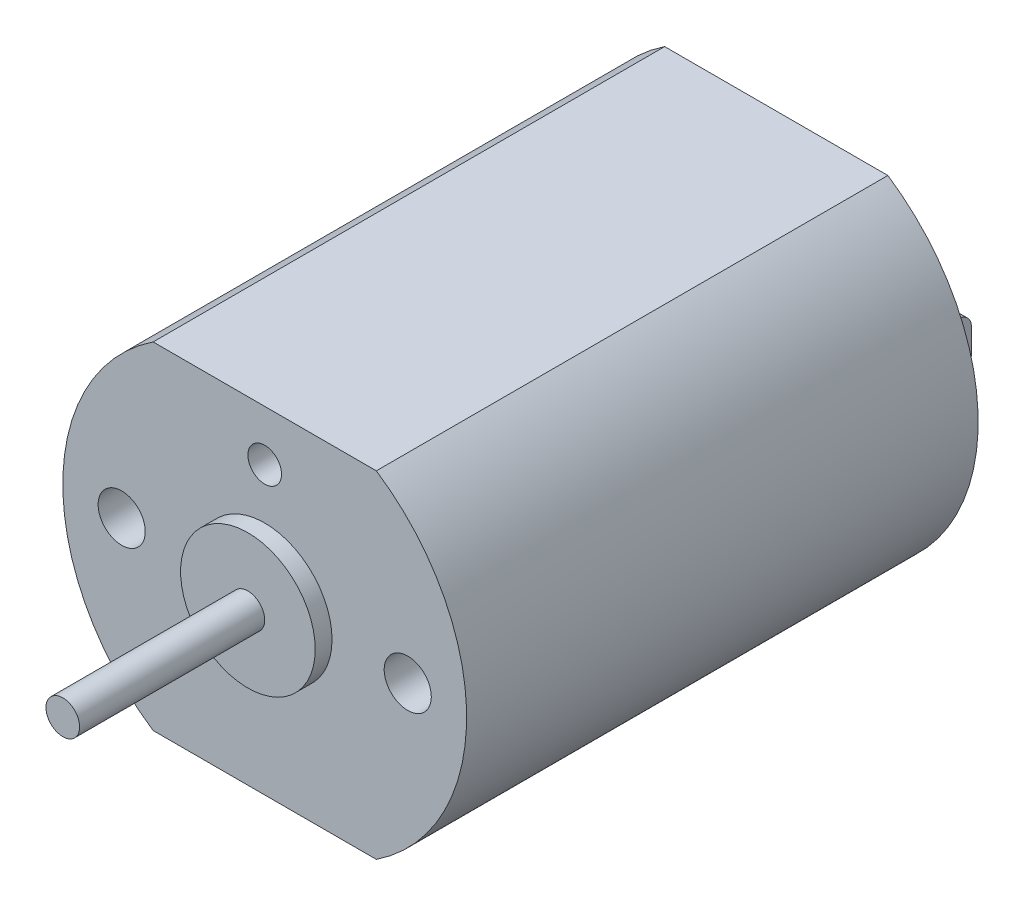
from build123d import *

# Parameters (mm, degrees)
SKETCH_1_W          = 0.3
SKETCH_1_H          = 1.5
SKETCH_1_R          = 2.5
SKETCH_1_R_2        = 1.5
EXTRUDE_1_DEPTH     = 15.2
SKETCH_1_4_W        = 0.3
SKETCH_1_4_H        = 1.5
EXTRUDE_2_DEPTH     = 2
CUT_EXTRUDE_2_DEPTH = 19.763794925
FILLET_1_R          = 0.4
SKETCH_1_5_R        = 2.5
SKETCH_1_5_R_2      = 1.5
EXTRUDE_3_DEPTH     = 1.2
CUT_EXTRUDE_START   = -1.2
SKETCH_1_7_R        = 1.5
CUT_EXTRUDE_1_DEPTH = 0.6
FILLET_2_R          = 0.4
SKETCH_3_R          = 2
EXTRUDE_4_DEPTH     = 0.5
SKETCH_3_3_R        = 0.5
EXTRUDE_5_DEPTH     = 6
SKETCH_4_R          = 0.7
SKETCH_4_R_2        = 0.5
CUT_EXTRUDE_3_DEPTH = 1


with BuildPart() as part:
    # 草图1 → 凸台-拉伸1 (new body)
    # profile 1 of 5: a face of its own
    with BuildSketch(Plane.XY):
        with BuildLine():
            ThreePointArc((-6, 0), (-5.286764074, -2.837274331), (-3.31662479, -5))
            Line((-3.31662479, -5), (3.31662479, -5))
            ThreePointArc((3.31662479, -5), (5.286764074, -2.837274331), (6, 0))
            ThreePointArc((6, 0), (5.286764074, 2.837274331), (3.31662479, 5))
            Line((3.31662479, 5), (-3.31662479, 5))
            ThreePointArc((-3.31662479, 5), (-5.286764074, 2.837274331), (-6, 0))
        make_face()
        with Locations((-3.65, 0)):
            Rectangle(SKETCH_1_W, SKETCH_1_H, mode=Mode.SUBTRACT)
        Circle(SKETCH_1_R, mode=Mode.SUBTRACT)
        with Locations((3.65, 0)):
            Rectangle(SKETCH_1_W, SKETCH_1_H, mode=Mode.SUBTRACT)
    # profile 2 of 5: a face of its own
    with BuildSketch(Plane.XY):
        Circle(SKETCH_1_R)
        Circle(SKETCH_1_R_2, mode=Mode.SUBTRACT)
    # profile 3 of 5: a face of its own
    with BuildSketch(Plane.XY):
        Circle(SKETCH_1_R_2)
    # profile 4 of 5: a face of its own
    with BuildSketch(Plane.XY):
        with Locations((3.65, 0)):
            Rectangle(SKETCH_1_W, SKETCH_1_H)
    # profile 5 of 5: a face of its own
    with BuildSketch(Plane.XY):
        with Locations((-3.65, 0)):
            Rectangle(SKETCH_1_W, SKETCH_1_H)
    extrude(amount=EXTRUDE_1_DEPTH)

    # 草图1<4> → 凸台-拉伸2 (add)
    with BuildSketch(Plane.XY):
        with Locations((3.65, 0)):
            Rectangle(SKETCH_1_4_W, SKETCH_1_4_H)
        with Locations((-3.65, 0)):
            Rectangle(SKETCH_1_4_W, SKETCH_1_4_H)
    extrude(amount=-EXTRUDE_2_DEPTH)

    # 草图2 → 切除-拉伸2 (cut, through all)
    with BuildSketch(Plane(origin=(3.8, 0, 0), x_dir=(0, 0, -1), z_dir=(1, 0, 0))):
        with BuildLine():
            Line((0.95, 0.45), (1.05, 0.45))
            ThreePointArc((1.05, 0.45), (1.5, 0), (1.05, -0.45))
            Line((1.05, -0.45), (0.95, -0.45))
            ThreePointArc((0.95, -0.45), (0.5, 0), (0.95, 0.45))
        make_face()
    extrude(amount=-CUT_EXTRUDE_2_DEPTH, mode=Mode.SUBTRACT)

    # 圆角1
    fillet_1_edges = [part.edges().sort_by_distance(p)[0] for p in [
        (3.65, -0.75, -2),
        (3.65, 0.75, -2),
        (-3.65, -0.75, -2),
        (-3.65, 0.75, -2),
    ]]
    fillet(fillet_1_edges, radius=FILLET_1_R)

    # 草图1<5> → 凸台-拉伸3 (add)
    # profile 1 of 2: a face of its own
    with BuildSketch(Plane.XY):
        Circle(SKETCH_1_5_R)
        Circle(SKETCH_1_5_R_2, mode=Mode.SUBTRACT)
    # profile 2 of 2: a face of its own
    with BuildSketch(Plane.XY):
        Circle(SKETCH_1_5_R_2)
    extrude(amount=-EXTRUDE_3_DEPTH)

    # 草图1<7> → 切除-拉伸1 (cut)
    with BuildSketch(Plane.XY.offset(CUT_EXTRUDE_START)):
        Circle(SKETCH_1_7_R)
    extrude(amount=CUT_EXTRUDE_1_DEPTH, mode=Mode.SUBTRACT)

    # 圆角2
    fillet_2_edges = [part.edges().sort_by_distance(p)[0] for p in [
        (-2.5, 0, -1.2),
    ]]
    fillet(fillet_2_edges, radius=FILLET_2_R)

    # 草图3 → 凸台-拉伸4 (add)
    with BuildSketch(Plane.XY.offset(15.2)):
        Circle(SKETCH_3_R)
    extrude(amount=EXTRUDE_4_DEPTH)

    # 草图3<3> → 凸台-拉伸5 (add)
    with BuildSketch(Plane.XY.offset(15.2)):
        Circle(SKETCH_3_3_R)
    extrude(amount=EXTRUDE_5_DEPTH)

    # 草图4 → 切除-拉伸3 (cut)
    with BuildSketch(Plane.XY.offset(15.2)):
        with Locations((-4.25, 0)):
            Circle(SKETCH_4_R)
        with Locations((4.25, 0)):
            Circle(SKETCH_4_R)
        with Locations((0, 3.5)):
            Circle(SKETCH_4_R_2)
    extrude(amount=-CUT_EXTRUDE_3_DEPTH, mode=Mode.SUBTRACT)


solid = part.part
